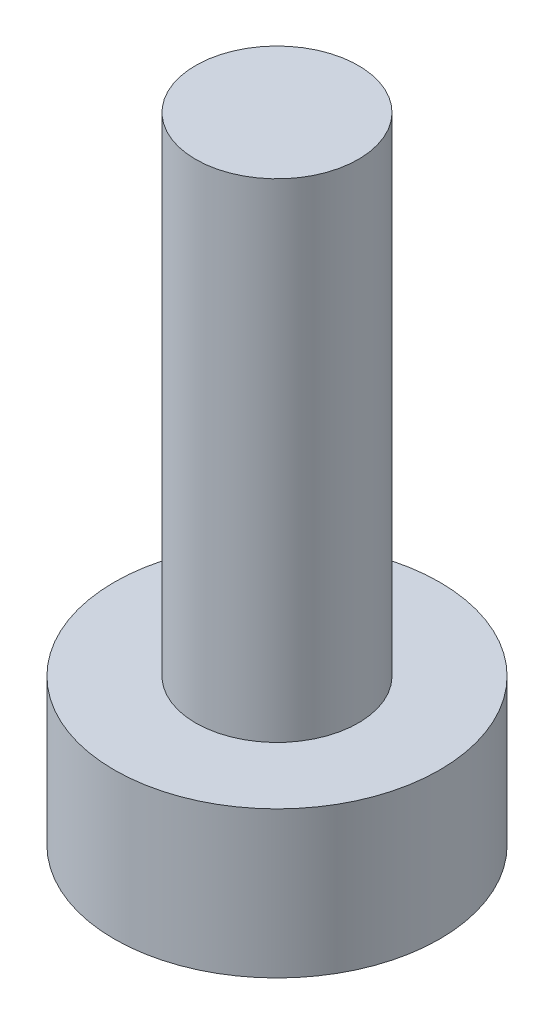
from build123d import *

# Parameters (mm, degrees)
SKETCH1_R           = 3
BOSS_EXTRUDE1_DEPTH = 2.7
SKETCH2_R           = 1.5
BOSS_EXTRUDE2_DEPTH = 9


with BuildPart() as part:
    # Sketch1 → Boss-Extrude1 (new body)
    with BuildSketch(Plane(origin=(0, 0, 0), x_dir=(1, 0, 0), z_dir=(0, 1, 0))):
        with Locations(Location((0, 0, 0), (0, 0, 90))):
            Circle(SKETCH1_R)
    extrude(amount=BOSS_EXTRUDE1_DEPTH)

    # Sketch2 → Boss-Extrude2 (add)
    with BuildSketch(Plane(origin=(0, 2.7, 0), x_dir=(1, 0, 0), z_dir=(0, 1, 0))):
        with Locations(Location((0, 0, 0), (0, 0, 270))):
            Circle(SKETCH2_R)
    extrude(amount=BOSS_EXTRUDE2_DEPTH)


solid = part.part
